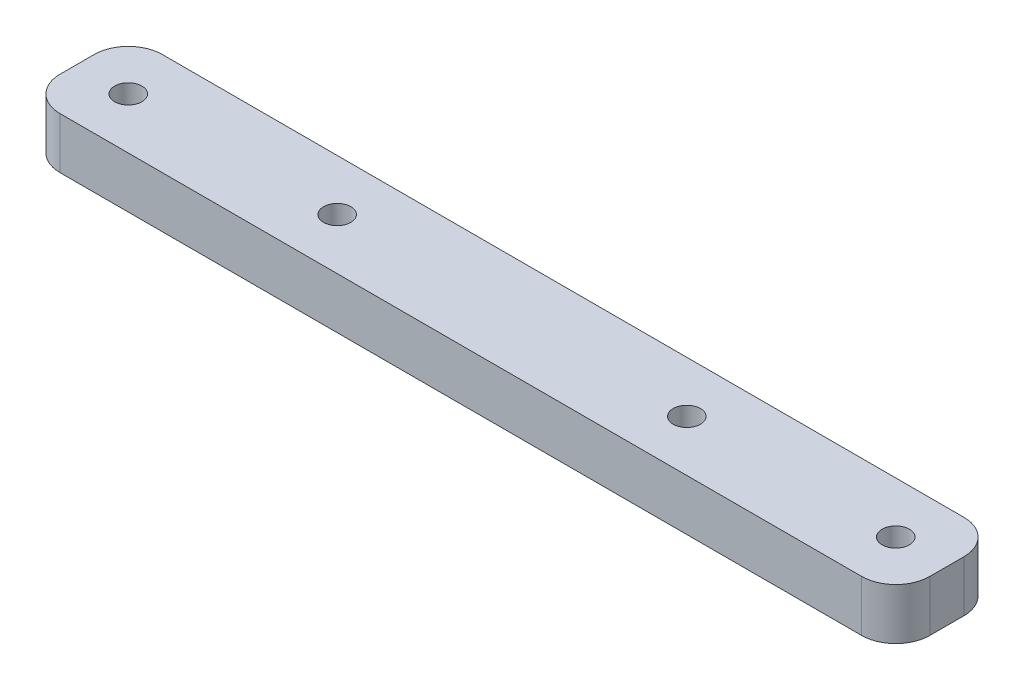
from build123d import *

# Parameters (mm, degrees)
SKETCH1_W           = 102
SKETCH1_H           = 12
SKETCH1_R           = 1.6
BOSS_EXTRUDE1_DEPTH = 3
FILLET1_R           = 4


with BuildPart() as part:
    # Sketch1 → Boss-Extrude1 (new, symmetric)
    with BuildSketch(Plane(origin=(0, 0, 0), x_dir=(1, 0, 0), z_dir=(0, 1, 0))):
        Rectangle(SKETCH1_W, SKETCH1_H)
        with Locations(Location((-45, 0, 0), (0, 0, 270))):
            Circle(SKETCH1_R, mode=Mode.SUBTRACT)
        with Locations(Location((-20.5, 0, 0), (0, 0, 270))):
            Circle(SKETCH1_R, mode=Mode.SUBTRACT)
        with Locations(Location((20.5, 0, 0), (0, 0, 270))):
            Circle(SKETCH1_R, mode=Mode.SUBTRACT)
        with Locations(Location((45, 0, 0), (0, 0, 270))):
            Circle(SKETCH1_R, mode=Mode.SUBTRACT)
    extrude(amount=BOSS_EXTRUDE1_DEPTH, both=True)

    # Fillet1
    fillet1_edges = [part.edges().sort_by_distance(p)[0] for p in [
        (51, 0, 6),
        (-51, 0, 6),
        (-51, 0, -6),
        (51, 0, -6),
    ]]
    fillet(fillet1_edges, radius=FILLET1_R)


solid = part.part
